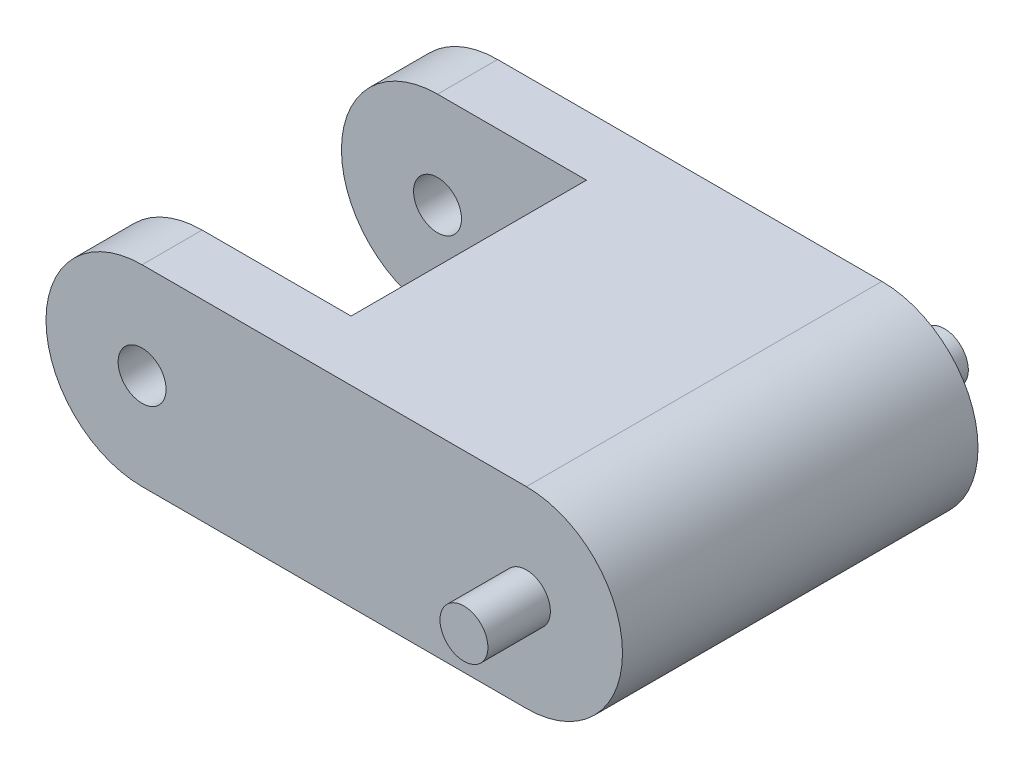
from build123d import *

# Parameters (mm, degrees)
CROQUIS1_R                    = 9.977
SALIENTE_EXTRUIR9_DEPTH       = 148
SALIENTE_EXTRUIR10_DEPTH      = 26
SALIENTE_EXTRUIR10_DEPTH_BACK = 174
CROQUIS8_R                    = 9.977
CROQUIS9_W                    = 114.38894851
CROQUIS9_H                    = 98
CORTAR_EXTRUIR2_DEPTH         = 131


with BuildPart() as part:
    # Croquis1 → Saliente-Extruir9 (new body)
    with BuildSketch(Plane.XY):
        with BuildLine():
            Line((0, 40), (160, 40))
            ThreePointArc((160, 40), (200, 0), (160, -40))
            Line((160, -40), (0, -40))
            ThreePointArc((0, -40), (-40, 0), (0, 40))
        make_face()
        Circle(CROQUIS1_R, mode=Mode.SUBTRACT)
    extrude(amount=SALIENTE_EXTRUIR9_DEPTH)

    # Croquis8 → Saliente-Extruir10 (add, two sides: drawn at the far end of the back side and taken through both)
    with BuildSketch(Plane(origin=(0, 0, 0), x_dir=(-1, 0, 0), z_dir=(0, 0, -1)).offset(-SALIENTE_EXTRUIR10_DEPTH_BACK)):
        with Locations((-160, 0)):
            Circle(CROQUIS8_R)
    extrude(amount=SALIENTE_EXTRUIR10_DEPTH + SALIENTE_EXTRUIR10_DEPTH_BACK)

    # Croquis9 → Cortar-Extruir2 (cut)
    with BuildSketch(Plane(origin=(0, 40, 0), x_dir=(1, 0, 0), z_dir=(0, 1, 0))):
        with Locations((4.810807807, -74)):
            Rectangle(CROQUIS9_W, CROQUIS9_H)
    extrude(amount=-CORTAR_EXTRUIR2_DEPTH, mode=Mode.SUBTRACT)


solid = part.part
